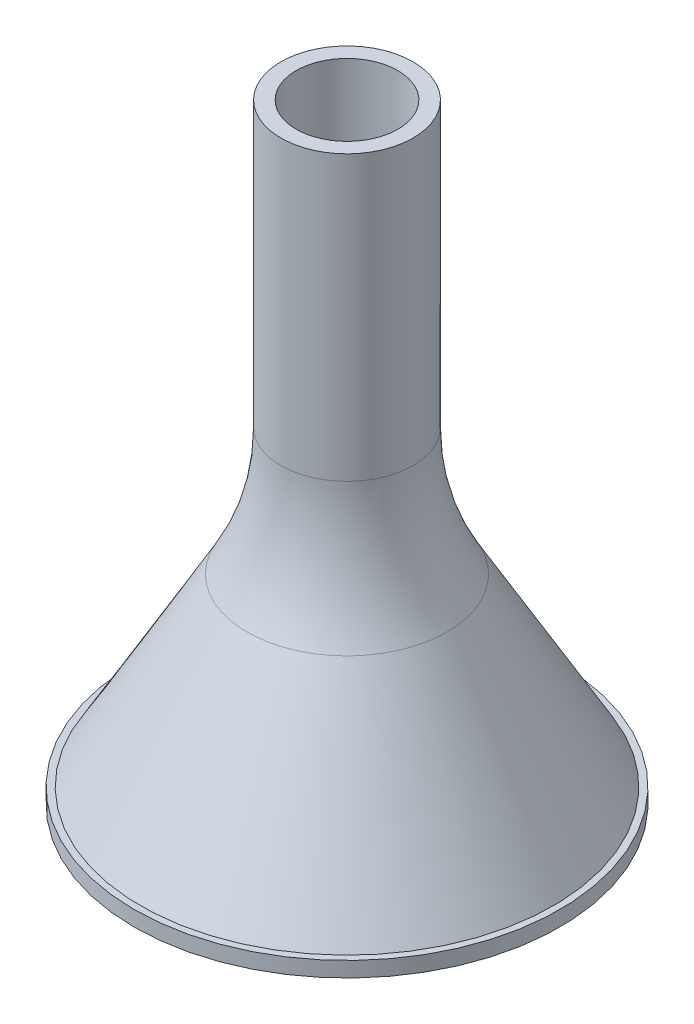
from build123d import *

# Parameters (mm, degrees)
SKETCH_2_R      = 10
SKETCH_2_R_2    = 4
EXTRUDE_1_DEPTH = 5
FILLET_1_R      = 50


with BuildPart() as part:
    # 草图1 → 旋转-薄壁1 (revolve)
    with BuildSketch(Plane.XY, mode=Mode.PRIVATE) as revolve_1_sk:
        Polygon((10, 120), (10, 50), (38.867513459, 0), (41.867513459, 0), (41.867513459, 3), (40.599564267, 3), (13, 50.803847577), (13, 120), align=None)
    revolve(revolve_1_sk.sketch.rotate(Axis((0, 0, 0), (0, 1, 0)), 90), axis=Axis((0, 0, 0), (0, 1, 0)))

    # 草图2 → 凸台-拉伸1 (add)
    with BuildSketch(Plane(origin=(0, 50, 0), x_dir=(1, 0, 0), z_dir=(0, 1, 0))):
        with Locations(Location((0, 0, 0), (0, 0, 90))):
            Circle(SKETCH_2_R)
        with Locations(Location((0, 0, 0), (0, 0, 270))):
            Circle(SKETCH_2_R_2, mode=Mode.SUBTRACT)
    extrude(amount=EXTRUDE_1_DEPTH)

    # 圆角1
    fillet_1_edges = [part.edges().sort_by_distance(p)[0] for p in [
        (0, 50.803847577, 13),
    ]]
    fillet(fillet_1_edges, radius=FILLET_1_R)


solid = part.part
